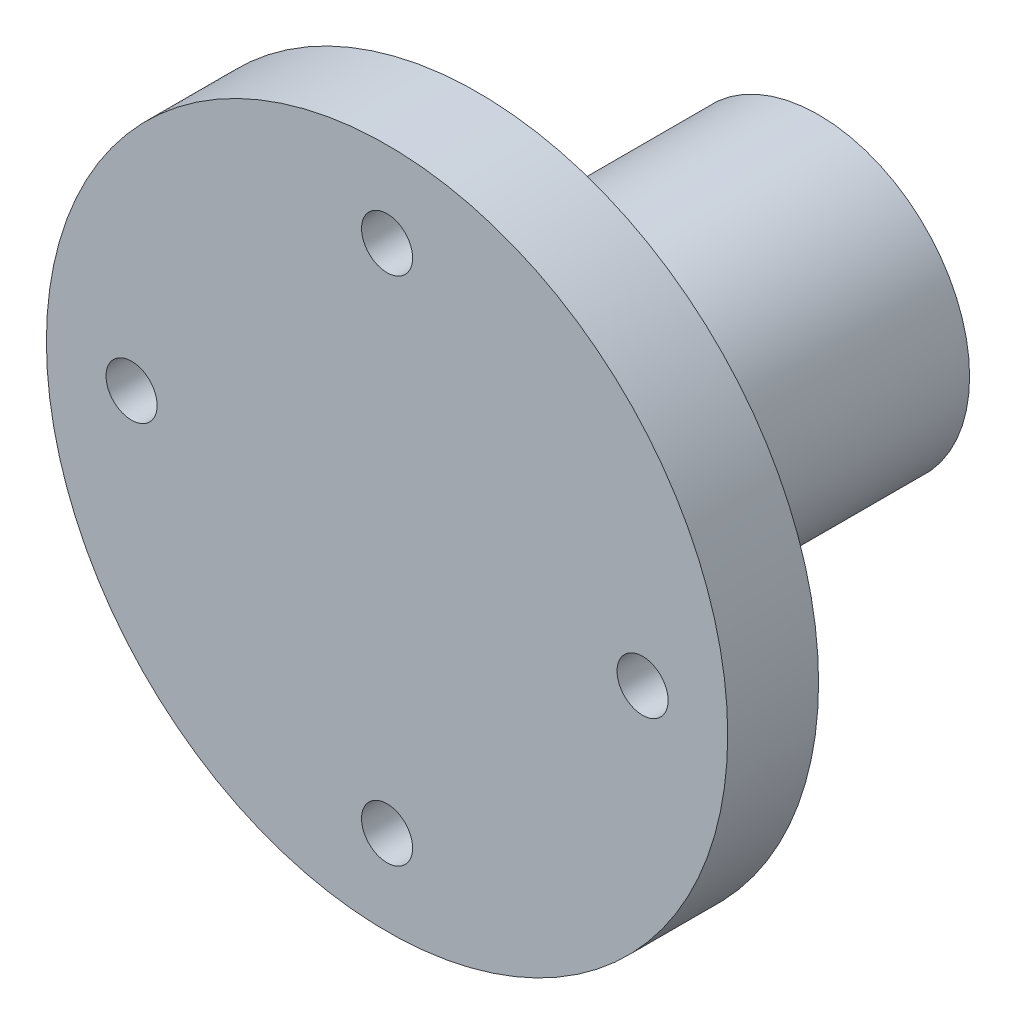
from build123d import *

# Parameters (mm, degrees)
CROQUIS1_R              = 13.3
SALIENTE_EXTRUIR1_DEPTH = 30
CROQUIS2_R              = 30
CROQUIS2_R_2            = 2.25
SALIENTE_EXTRUIR2_DEPTH = 8


with BuildPart() as part:
    # Croquis1 → Saliente-Extruir1 (new body)
    with BuildSketch(Plane.XY):
        Circle(CROQUIS1_R)
    extrude(amount=-SALIENTE_EXTRUIR1_DEPTH)

    # Croquis2 → Saliente-Extruir2 (add)
    with BuildSketch(Plane.XY):
        Circle(CROQUIS2_R)
        with Locations((0, 22.5)):
            Circle(CROQUIS2_R_2, mode=Mode.SUBTRACT)
        with Locations((22.5, 0)):
            Circle(CROQUIS2_R_2, mode=Mode.SUBTRACT)
        with Locations((0, -22.5)):
            Circle(CROQUIS2_R_2, mode=Mode.SUBTRACT)
        with Locations((-22.5, 0)):
            Circle(CROQUIS2_R_2, mode=Mode.SUBTRACT)
    extrude(amount=SALIENTE_EXTRUIR2_DEPTH)


solid = part.part
